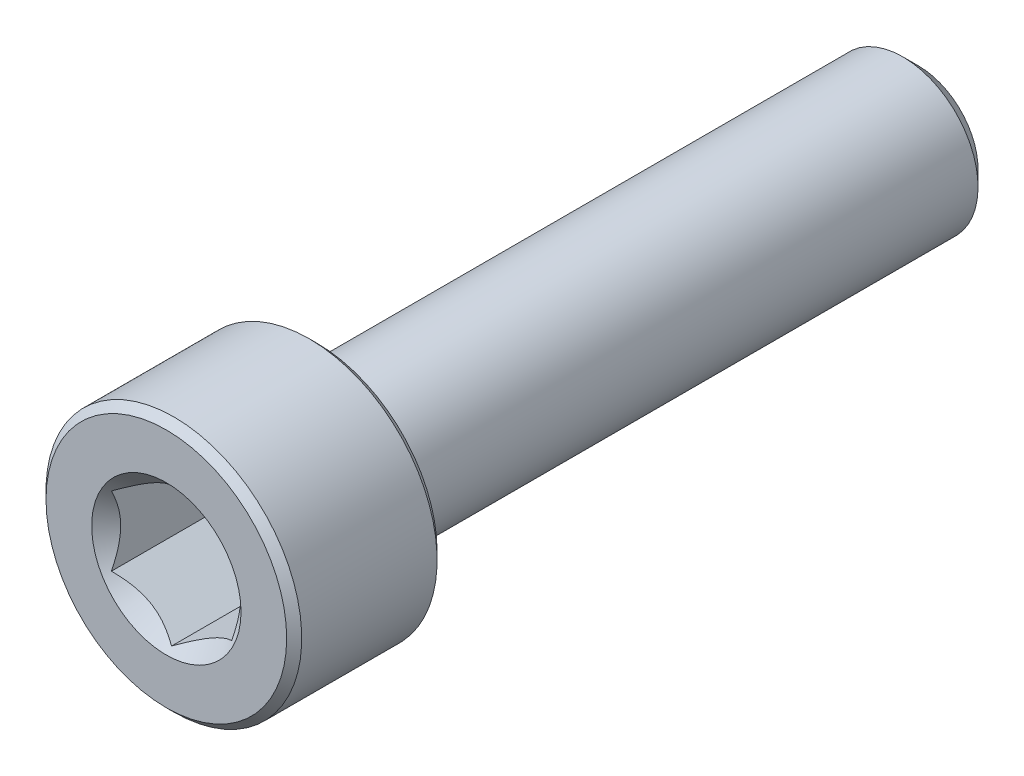
from build123d import *

# Parameters (mm, degrees)
CUT_EXTRUDE1_DEPTH = 4


with BuildPart() as part:
    # Sketch2 → Revolve1 (revolve)
    with BuildSketch(Plane(origin=(0, 0, 0), x_dir=(0, 0, -1), z_dir=(1, 0, 0))):
        with BuildLine():
            Line((-12.5, 0), (-12.5, 4))
            Line((-12.5, 4), (-12.25, 4.25))
            Line((-12.25, 4.25), (-7.75, 4.25))
            Line((-7.75, 4.25), (-7.5, 4))
            Line((-7.5, 4), (-7.5, 2.75))
            ThreePointArc((-7.5, 2.75), (-7.426776695, 2.573223305), (-7.25, 2.5))
            Line((-7.25, 2.5), (11.980384758, 2.5))
            Line((11.980384758, 2.5), (12.5, 1.980384758))
            Line((12.5, 1.980384758), (12.5, 0))
            Line((12.5, 0), (-12.5, 0))
        make_face()
    revolve(axis=Axis((0, 0, -12.5), (0, 0, 1)))

    # Sketch3 → Cut-Extrude1 (cut)
    with BuildSketch(Plane.XY.offset(12.5)):
        Polygon((2, -1.154700538), (2, 1.154700538), (0, 2.309401077), (-2, 1.154700538), (-2, -1.154700538), (0, -2.309401077), align=None)
    extrude(amount=-CUT_EXTRUDE1_DEPTH, mode=Mode.SUBTRACT)

    # Cut-Extrude2 cone 1 section (through the dimple's axis) → Cut-Extrude2 (revolve, cut)
    with BuildSketch(Plane(origin=(0, 0, 12.5), x_dir=(0, -1, 0), z_dir=(1, 0, 0))):
        Polygon((0, 0), (2.482606158, 0), (0, 2.482606158), align=None)
    revolve(axis=Axis((0, 0, 12.5), (0, 0, -1)), mode=Mode.SUBTRACT)


solid = part.part
